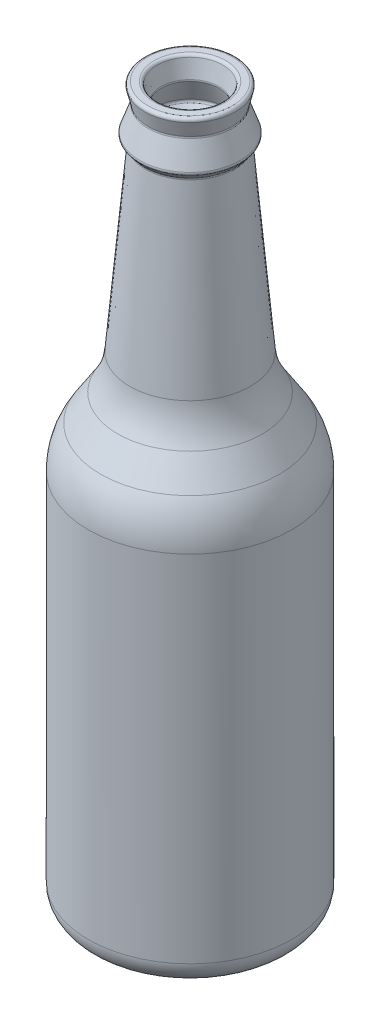
from build123d import *

# Parameters (mm, degrees)
SHELL2_T  = -4
FILLET4_R = 25
FILLET5_R = 1


with BuildPart() as part:
    # Sketch4 → Revolve2 (revolve)
    with BuildSketch(Plane.XY, mode=Mode.PRIVATE) as revolve2_sk:
        with BuildLine():
            Line((0, 0), (25.170523287, 0))
            ThreePointArc((25.170523287, 0), (30.558952692, 2.231960539), (32.790913232, 7.620389945))
            Line((32.790913232, 7.620389945), (32.790913232, 129.326876863))
            Line((32.790913232, 129.326876863), (19.994320951, 149.216732244))
            Line((19.994320951, 149.216732244), (14.324154496, 213.814074554))
            Line((14.324154496, 213.814074554), (16.371178566, 216.255041386))
            Line((16.371178566, 216.255041386), (13.417625864, 224.634729952))
            Line((13.417625864, 224.634729952), (14.894402215, 230.795828182))
            Line((14.894402215, 230.795828182), (0, 230.795828182))
            Line((0, 230.795828182), (0, 0))
        make_face()
    revolve(revolve2_sk.sketch.rotate(Axis((0, 0, 0), (0, 1, 0)), 90), axis=Axis((0, 0, 0), (0, 1, 0)))

    # Shell2
    shell2_openings = [part.faces().sort_by_distance(p)[0] for p in [
        (0, 230.795828182, 0),
    ]]
    offset(amount=SHELL2_T, openings=shell2_openings, kind=Kind.INTERSECTION)

    # Fillet4
    fillet4_edges = [part.edges().sort_by_distance(p)[0] for p in [
        (0, 149.216732244, 19.994320951),
        (0, 129.326876863, 32.790913232),
    ]]
    fillet(fillet4_edges, radius=FILLET4_R)

    # Fillet5
    fillet5_edges = [part.edges().sort_by_distance(p)[0] for p in [
        (0, 215.114819076, 10.194598867),
        (0, 217.077139894, 11.840224647),
        (0, 224.418756124, 9.252556826),
        (0, 230.795828182, 10.781100741),
        (0, 230.795828182, 14.894402215),
        (0, 224.634729952, 13.417625864),
        (0, 216.255041386, 16.371178566),
        (0, 213.814074554, 14.324154496),
    ]]
    fillet(fillet5_edges, radius=FILLET5_R)


solid = part.part
